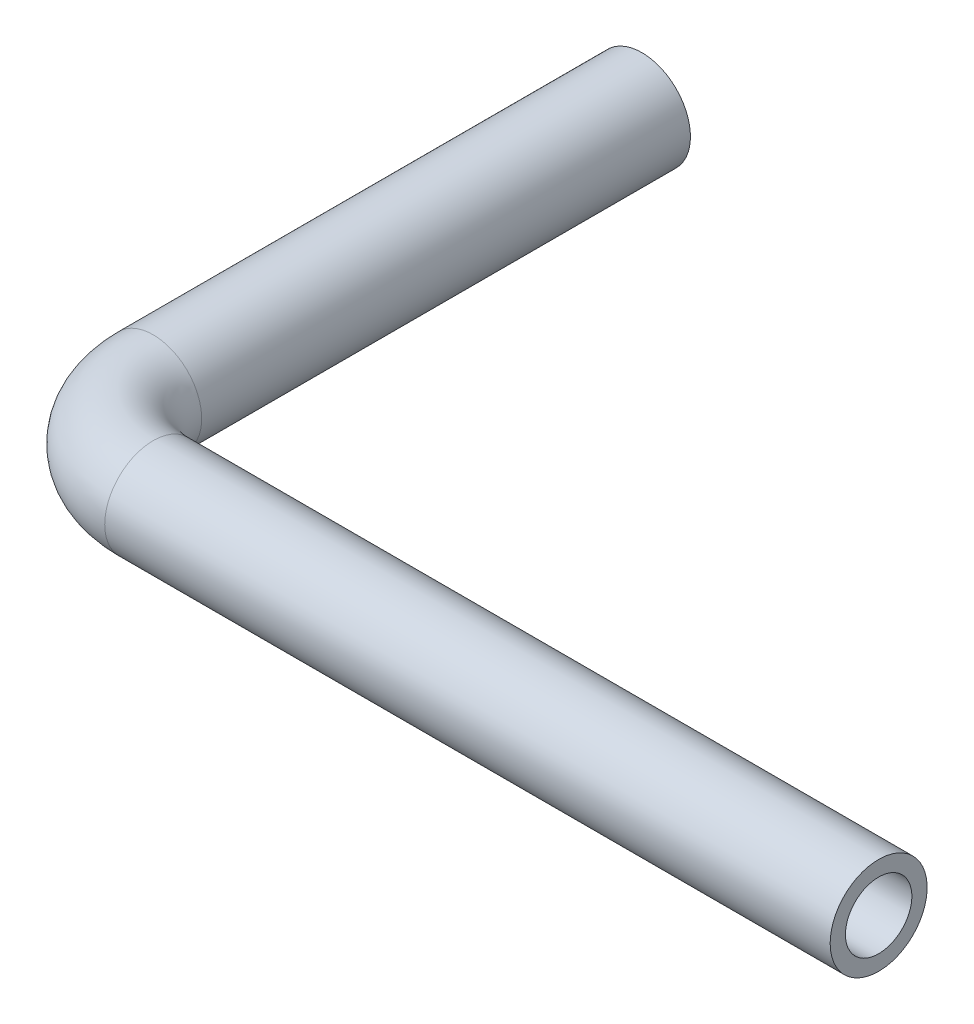
from build123d import *

# Parameters (mm, degrees)
TUBE_PROFILE_R   = 3.175
TUBE_PROFILE_R_2 = 2.175


with BuildPart() as part:
    # Tube: sweep along a curve in space
    with BuildLine() as tube_path:
        Line((-185, 40, 12), (-185, 40, 44))
        ThreePointArc((-179, 40, 50), (-183.242640687, 40, 48.242640687), (-185, 40, 44))
        Line((-179, 40, 50), (-131.5, 40, 50))
    # Tube profile (on start of the path) → Tube (sweep)
    with BuildSketch(Plane(origin=(-185, 40, 12), x_dir=(1, 0, 0), z_dir=(0, 0, 1))):
        Circle(TUBE_PROFILE_R)
        Circle(TUBE_PROFILE_R_2, mode=Mode.SUBTRACT)
    sweep(path=tube_path.line)


solid = part.part
